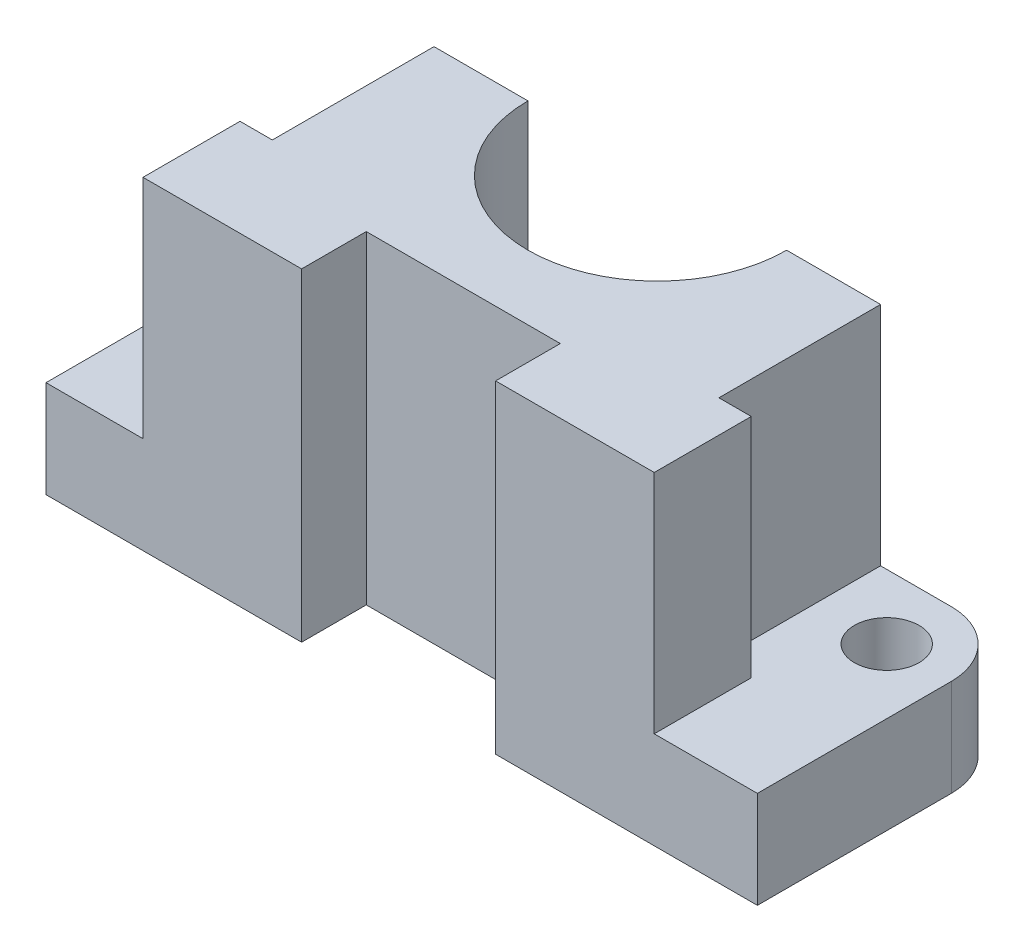
from build123d import *

# Parameters (mm, degrees)
SKETCH_1_R               = 5
EXTRUDE_1_DEPTH          = 50
CUT_EXTRUDE_1_DEPTH      = 128.279220614
CUT_EXTRUDE_1_DEPTH_BACK = 128.279220614
SKETCH_2_W               = 15
SKETCH_2_H               = 10
CUT_EXTRUDE_2_DEPTH      = 128.279220614
CUT_EXTRUDE_2_DEPTH_BACK = 35
SKETCH_4_R               = 5
CUT_EXTRUDE_3_DEPTH      = 20
CUT_EXTRUDE_4_DEPTH      = 121.830459736


with BuildPart() as part:
    # 草图1 → 凸台-拉伸1 (new body)
    with BuildSketch(Plane(origin=(0, 0, 0), x_dir=(1, 0, 0), z_dir=(0, 1, 0))):
        with BuildLine():
            Line((0, 0), (110, 0))
            Line((110, 0), (110, 30))
            ThreePointArc((110, 30), (107.071067812, 37.071067812), (100, 40))
            Line((100, 40), (10, 40))
            ThreePointArc((10, 40), (2.928932188, 37.071067812), (0, 30))
            Line((0, 30), (0, 0))
        make_face()
        with Locations(Location((10, 30, 0), (0, 0, 270))):
            Circle(SKETCH_1_R, mode=Mode.SUBTRACT)
        with Locations(Location((100, 30, 0), (0, 0, 270))):
            Circle(SKETCH_1_R, mode=Mode.SUBTRACT)
    extrude(amount=EXTRUDE_1_DEPTH)

    # 草图2 → 切除-拉伸1 (cut, two sides: drawn at the far end of the back side and taken through both)
    with BuildSketch(Plane(origin=(0, 50, 0), x_dir=(1, 0, 0), z_dir=(0, 1, 0)).offset(-CUT_EXTRUDE_1_DEPTH_BACK)):
        with Locations((47.026162845, 5)):
            Rectangle(SKETCH_2_W, SKETCH_2_H)
        with Locations((62.026162845, 5)):
            Rectangle(SKETCH_2_W, SKETCH_2_H)
    extrude(amount=CUT_EXTRUDE_1_DEPTH + CUT_EXTRUDE_1_DEPTH_BACK, mode=Mode.SUBTRACT)

    # 草图4 → 切除-拉伸2 (cut, two sides: drawn at the far end of the back side and taken through both)
    # profile 1 of 2: a face of its own
    with BuildSketch(Plane(origin=(0, 50, 0), x_dir=(1, 0, 0), z_dir=(0, 1, 0)).offset(-CUT_EXTRUDE_2_DEPTH_BACK)):
        with BuildLine():
            Line((0, 30), (0, 0))
            Line((0, 0), (15, 0))
            Line((15, 0), (15, 15))
            Line((15, 15), (20, 15))
            Line((20, 15), (20, 40))
            Line((20, 40), (10, 40))
            ThreePointArc((10, 40), (2.928932188, 37.071067812), (0, 30))
        make_face()
        with Locations(Location((10, 30, 0), (0, 0, 270))):
            Circle(SKETCH_4_R, mode=Mode.SUBTRACT)
    # profile 2 of 2: a face of its own
    with BuildSketch(Plane(origin=(0, 50, 0), x_dir=(1, 0, 0), z_dir=(0, 1, 0)).offset(-CUT_EXTRUDE_2_DEPTH_BACK)):
        with BuildLine():
            Line((100, 40), (89.052325689, 40))
            Line((89.052325689, 40), (89.052325689, 15))
            Line((89.052325689, 15), (94.052325689, 15))
            Line((94.052325689, 15), (94.052325689, 0))
            Line((94.052325689, 0), (109.052325689, 0))
            Line((109.052325689, 0), (110, 0))
            Line((110, 0), (110, 30))
            ThreePointArc((110, 30), (107.071067812, 37.071067812), (100, 40))
        make_face()
        with Locations(Location((100, 30, 0), (0, 0, 270))):
            Circle(SKETCH_4_R, mode=Mode.SUBTRACT)
    extrude(amount=CUT_EXTRUDE_2_DEPTH + CUT_EXTRUDE_2_DEPTH_BACK, mode=Mode.SUBTRACT)

    # 草图5 → 切除-拉伸3 (cut)
    with BuildSketch(Plane(origin=(0, 50, 0), x_dir=(1, 0, 0), z_dir=(0, 1, 0))):
        with BuildLine():
            ThreePointArc((64.526162845, 40), (61.597230656, 32.928932188), (54.526162845, 30))
            Line((54.526162845, 30), (54.526162845, 20))
            ThreePointArc((54.526162845, 20), (68.668298468, 25.857864376), (74.526162845, 40))
            Line((74.526162845, 40), (64.526162845, 40))
        make_face()
        with BuildLine():
            Line((54.526162845, 20), (54.526162845, 30))
            ThreePointArc((54.526162845, 30), (47.455095033, 32.928932188), (44.526162845, 40))
            Line((44.526162845, 40), (34.526162845, 40))
            ThreePointArc((34.526162845, 40), (40.384027221, 25.857864376), (54.526162845, 20))
        make_face()
        with BuildLine():
            ThreePointArc((64.526162845, 40), (61.597230656, 32.928932188), (54.526162845, 30))
            Line((54.526162845, 30), (54.526162845, 20))
            ThreePointArc((54.526162845, 20), (68.668298468, 25.857864376), (74.526162845, 40))
            Line((74.526162845, 40), (64.526162845, 40))
        make_face()
        with BuildLine():
            Line((54.526162845, 20), (54.526162845, 30))
            ThreePointArc((54.526162845, 30), (47.455095033, 32.928932188), (44.526162845, 40))
            Line((44.526162845, 40), (34.526162845, 40))
            ThreePointArc((34.526162845, 40), (40.384027221, 25.857864376), (54.526162845, 20))
        make_face()
        with BuildLine():
            Line((64.526162845, 40), (54.526162845, 40))
            Line((54.526162845, 40), (54.526162845, 30))
            ThreePointArc((54.526162845, 30), (61.597230656, 32.928932188), (64.526162845, 40))
        make_face()
        with BuildLine():
            Line((54.526162845, 30), (54.526162845, 40))
            Line((54.526162845, 40), (44.526162845, 40))
            ThreePointArc((44.526162845, 40), (47.455095033, 32.928932188), (54.526162845, 30))
        make_face()
        with BuildLine():
            Line((64.526162845, 40), (54.526162845, 40))
            Line((54.526162845, 40), (54.526162845, 30))
            ThreePointArc((54.526162845, 30), (61.597230656, 32.928932188), (64.526162845, 40))
        make_face()
        with BuildLine():
            Line((54.526162845, 30), (54.526162845, 40))
            Line((54.526162845, 40), (44.526162845, 40))
            ThreePointArc((44.526162845, 40), (47.455095033, 32.928932188), (54.526162845, 30))
        make_face()
    extrude(amount=-CUT_EXTRUDE_3_DEPTH, mode=Mode.SUBTRACT)

    # 草图6 → 切除-拉伸4 (cut, through all)
    with BuildSketch(Plane(origin=(0, 30, 0), x_dir=(1, 0, 0), z_dir=(0, 1, 0))):
        with BuildLine():
            ThreePointArc((44.526162845, 40), (54.526162845, 30), (64.526162845, 40))
            Line((64.526162845, 40), (44.526162845, 40))
        make_face()
    extrude(amount=-CUT_EXTRUDE_4_DEPTH, mode=Mode.SUBTRACT)


solid = part.part
